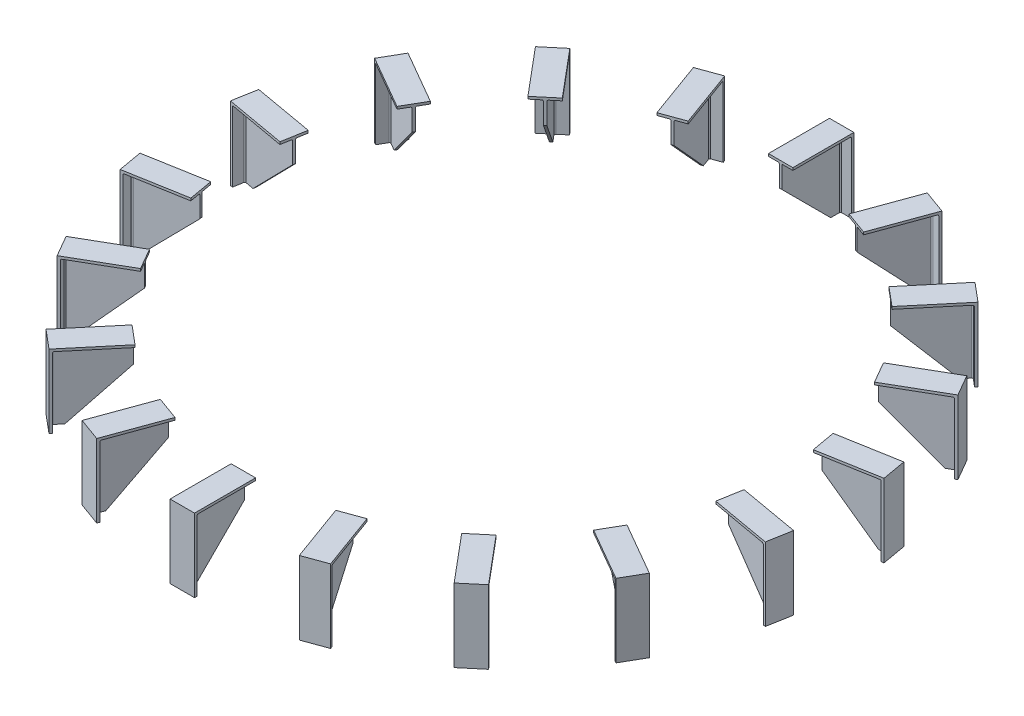
from build123d import *

# Parameters (mm, degrees)
SKETCH_3_W               = 100
SKETCH_3_H               = 500
EXTRUDE_2_DEPTH          = 600
CHAMFER_1_SIZE           = 400
CUT_EXTRUDE_START        = -90
SKETCH_4_W               = 480
SKETCH_4_H               = 580
CUT_EXTRUDE_1_DEPTH      = 90
FILLET_1_R               = 10
PATTERN_CIRCULAR_1_COUNT = 18


with BuildPart() as part:
    # ｽｹｯﾁ3 → ﾎﾞｽ - 押し出し2 (new body)
    with BuildSketch(Plane(origin=(0, 0, 0), x_dir=(-1, 0, 0), z_dir=(0, 1, 0))):
        with Locations((50, 2450)):
            Rectangle(SKETCH_3_W, SKETCH_3_H)
    extrude(amount=-EXTRUDE_2_DEPTH)

    # 面取り1
    chamfer_1_edges = [part.edges().sort_by_distance(p)[0] for p in [
        (-50, -600, 2200),
    ]]
    chamfer(chamfer_1_edges, length=CHAMFER_1_SIZE)

    # ｽｹｯﾁ4 → ｶｯﾄ - 押し出し1 (cut)
    with BuildSketch(Plane.ZY.offset(100).offset(CUT_EXTRUDE_START)):
        with Locations((2440, -310)):
            Rectangle(SKETCH_4_W, SKETCH_4_H)
    extrude(amount=CUT_EXTRUDE_1_DEPTH, mode=Mode.SUBTRACT)

    # ﾌｨﾚｯﾄ1
    fillet_1_edges = [part.edges().sort_by_distance(p)[0] for p in [
        (-10, -310, 2680),
        (-55, -20, 2680),
        (-10, -20, 2440),
    ]]
    fillet(fillet_1_edges, radius=FILLET_1_R)

    # ﾐﾗｰ2: part across plane


with BuildPart() as part_1:
    add(part.part)
    add(part.part.mirror(Plane(origin=(0, 0, 0), x_dir=(0, 0, 1), z_dir=(1, 0, 0))))


with BuildPart() as pattern_circular_1_1:
    # 円形ﾊﾟﾀｰﾝ1: pattern copy
    add(part_1.part.rotate(Axis((0, 0, 0), (0, 1, 0)), 1 * 360 / PATTERN_CIRCULAR_1_COUNT))


with BuildPart() as pattern_circular_1_2:
    # 円形ﾊﾟﾀｰﾝ1: pattern copy
    add(part_1.part.rotate(Axis((0, 0, 0), (0, 1, 0)), 2 * 360 / PATTERN_CIRCULAR_1_COUNT))


with BuildPart() as pattern_circular_1_3:
    # 円形ﾊﾟﾀｰﾝ1: pattern copy
    add(part_1.part.rotate(Axis((0, 0, 0), (0, 1, 0)), 3 * 360 / PATTERN_CIRCULAR_1_COUNT))


with BuildPart() as pattern_circular_1_4:
    # 円形ﾊﾟﾀｰﾝ1: pattern copy
    add(part_1.part.rotate(Axis((0, 0, 0), (0, 1, 0)), 4 * 360 / PATTERN_CIRCULAR_1_COUNT))


with BuildPart() as pattern_circular_1_5:
    # 円形ﾊﾟﾀｰﾝ1: pattern copy
    add(part_1.part.rotate(Axis((0, 0, 0), (0, 1, 0)), 5 * 360 / PATTERN_CIRCULAR_1_COUNT))


with BuildPart() as pattern_circular_1_6:
    # 円形ﾊﾟﾀｰﾝ1: pattern copy
    add(part_1.part.rotate(Axis((0, 0, 0), (0, 1, 0)), 6 * 360 / PATTERN_CIRCULAR_1_COUNT))


with BuildPart() as pattern_circular_1_7:
    # 円形ﾊﾟﾀｰﾝ1: pattern copy
    add(part_1.part.rotate(Axis((0, 0, 0), (0, 1, 0)), 7 * 360 / PATTERN_CIRCULAR_1_COUNT))


with BuildPart() as pattern_circular_1_8:
    # 円形ﾊﾟﾀｰﾝ1: pattern copy
    add(part_1.part.rotate(Axis((0, 0, 0), (0, 1, 0)), 8 * 360 / PATTERN_CIRCULAR_1_COUNT))


with BuildPart() as pattern_circular_1_9:
    # 円形ﾊﾟﾀｰﾝ1: pattern copy
    add(part_1.part.rotate(Axis((0, 0, 0), (0, 1, 0)), 9 * 360 / PATTERN_CIRCULAR_1_COUNT))


with BuildPart() as pattern_circular_1_10:
    # 円形ﾊﾟﾀｰﾝ1: pattern copy
    add(part_1.part.rotate(Axis((0, 0, 0), (0, 1, 0)), 10 * 360 / PATTERN_CIRCULAR_1_COUNT))


with BuildPart() as pattern_circular_1_11:
    # 円形ﾊﾟﾀｰﾝ1: pattern copy
    add(part_1.part.rotate(Axis((0, 0, 0), (0, 1, 0)), 11 * 360 / PATTERN_CIRCULAR_1_COUNT))


with BuildPart() as pattern_circular_1_12:
    # 円形ﾊﾟﾀｰﾝ1: pattern copy
    add(part_1.part.rotate(Axis((0, 0, 0), (0, 1, 0)), 12 * 360 / PATTERN_CIRCULAR_1_COUNT))


with BuildPart() as pattern_circular_1_13:
    # 円形ﾊﾟﾀｰﾝ1: pattern copy
    add(part_1.part.rotate(Axis((0, 0, 0), (0, 1, 0)), 13 * 360 / PATTERN_CIRCULAR_1_COUNT))


with BuildPart() as pattern_circular_1_14:
    # 円形ﾊﾟﾀｰﾝ1: pattern copy
    add(part_1.part.rotate(Axis((0, 0, 0), (0, 1, 0)), 14 * 360 / PATTERN_CIRCULAR_1_COUNT))


with BuildPart() as pattern_circular_1_15:
    # 円形ﾊﾟﾀｰﾝ1: pattern copy
    add(part_1.part.rotate(Axis((0, 0, 0), (0, 1, 0)), 15 * 360 / PATTERN_CIRCULAR_1_COUNT))


with BuildPart() as pattern_circular_1_16:
    # 円形ﾊﾟﾀｰﾝ1: pattern copy
    add(part_1.part.rotate(Axis((0, 0, 0), (0, 1, 0)), 16 * 360 / PATTERN_CIRCULAR_1_COUNT))


with BuildPart() as pattern_circular_1_17:
    # 円形ﾊﾟﾀｰﾝ1: pattern copy
    add(part_1.part.rotate(Axis((0, 0, 0), (0, 1, 0)), 17 * 360 / PATTERN_CIRCULAR_1_COUNT))


solid = Compound([part_1.part, pattern_circular_1_1.part, pattern_circular_1_2.part, pattern_circular_1_3.part, pattern_circular_1_4.part, pattern_circular_1_5.part, pattern_circular_1_6.part, pattern_circular_1_7.part, pattern_circular_1_8.part, pattern_circular_1_9.part, pattern_circular_1_10.part, pattern_circular_1_11.part, pattern_circular_1_12.part, pattern_circular_1_13.part, pattern_circular_1_14.part, pattern_circular_1_15.part, pattern_circular_1_16.part, pattern_circular_1_17.part])
